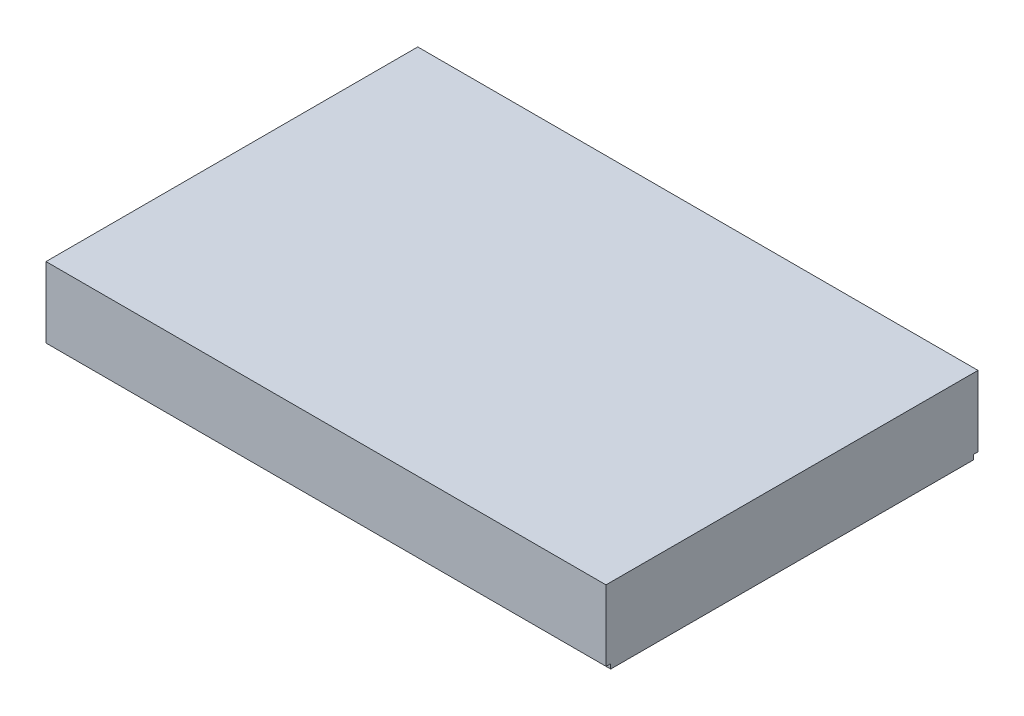
from build123d import *

# Parameters (mm, degrees)
MAINBASESKETCH_W              = 47.8
MAINBASESKETCH_H              = 3.2
MAINBASEEXTRUDE_DEPTH         = 7.9
MAINBASESHELL_T               = -1.2
UNDERSIDECIRCLEEXT_START      = -0.2
UNDERSIDECIRCLESKETCH_R       = 3.25
UNDERSIDECIRCLESKETCH_R_2     = 2.4
UNDERSIDECIRCLEEXT_DEPTH      = 2.4
UNDERSIDECIRCLEPATTERN_COUNT  = 2
UNDERSIDECIRCLEPATTERN_PITCH  = 8
EXTENDEDBASEEDGECUT_DEPTH     = 0.2
EXTENDEDBASEEDGECUT2_DEPTH    = 0.2
EXTENDEDBASEEDGECUT3_DEPTH    = 0.2
EXTENDEDBASEEDGESKETCH4_W     = 47.4
EXTENDEDBASEEDGESKETCH4_H     = 0.199766916
EXTENDEDBASEEDGECUT4_DEPTH    = 0.2
EXTENDEDNBASEUNDERNOTCH_DEPTH = 0.4
EXTENDEBASENOTCHFILLET_R      = 0.2
CUT_EXTRUDE61_DEPTH           = 50.22551315
CUT_EXTRUDE61_DEPTH_BACK      = 50.22551315


with BuildPart() as part:
    # MainBaseSketch → MainBaseExtrude (new, symmetric)
    with BuildSketch(Plane.XY):
        with Locations((24.581967213, 1.6)):
            Rectangle(MAINBASESKETCH_W, MAINBASESKETCH_H)
    extrude(amount=MAINBASEEXTRUDE_DEPTH, both=True)

    # MainBaseShell
    mainbaseshell_openings = [part.faces().sort_by_distance(p)[0] for p in [
        (24.581967213, 0, 0),
    ]]
    offset(amount=MAINBASESHELL_T, openings=mainbaseshell_openings, kind=Kind.INTERSECTION)

    # UnderSideCircleSketch → UnderSideCircleExt (add)
    with BuildSketch(Plane.XZ.offset(-2).offset(UNDERSIDECIRCLEEXT_START)):
        with Locations((8.581967213, 0)):
            Circle(UNDERSIDECIRCLESKETCH_R)
        with Locations((8.581967213, 0)):
            Circle(UNDERSIDECIRCLESKETCH_R_2, mode=Mode.SUBTRACT)
    undersidecircleext = extrude(amount=UNDERSIDECIRCLEEXT_DEPTH)

    # UnderSideCirclePattern: UnderSideCircleExt ×2
    with Locations(*[(i * UNDERSIDECIRCLEPATTERN_PITCH, 0, 0) for i in range(1, UNDERSIDECIRCLEPATTERN_COUNT)]):
        add(undersidecircleext)

    # ExtendedBaseEdgeSketch → ExtendedBaseEdgeCut (cut)
    with BuildSketch(Plane.ZY.offset(-0.681967213)):
        Polygon((-7.9, 0), (-7.9, 0.199766916), (-7.702184024, 0.199766916), (7.702184024, 0.199766916), (7.9, 0.199766916), (7.9, 0), (7.702184024, 0), (-7.702184024, 0), align=None)
    extrude(amount=-EXTENDEDBASEEDGECUT_DEPTH, mode=Mode.SUBTRACT)

    # ExtendedBaseEdgeSketch2 → ExtendedBaseEdgeCut2 (cut)
    with BuildSketch(Plane(origin=(0, 0, -7.9), x_dir=(-1, 0, 0), z_dir=(0, 0, -1))):
        Polygon((-48.481967213, 0), (-48.481967213, 0.203418418), (-0.881967213, 0.199766916), (-0.881967213, 0), align=None)
    extrude(amount=-EXTENDEDBASEEDGECUT2_DEPTH, mode=Mode.SUBTRACT)

    # ExtendedBaseEdgeSketch3 → ExtendedBaseEdgeCut3 (cut)
    with BuildSketch(Plane(origin=(48.481967213, 0, 0), x_dir=(0, 0, -1), z_dir=(1, 0, 0))):
        Polygon((-7.9, 0), (-7.9, 0.199766916), (7.7, 0.203418418), (7.7, 0), align=None)
    extrude(amount=-EXTENDEDBASEEDGECUT3_DEPTH, mode=Mode.SUBTRACT)

    # ExtendedBaseEdgeSketch4 → ExtendedBaseEdgeCut4 (cut)
    with BuildSketch(Plane.XY.offset(7.9)):
        with Locations((24.581967213, 0.099883458)):
            Rectangle(EXTENDEDBASEEDGESKETCH4_W, EXTENDEDBASEEDGESKETCH4_H)
    extrude(amount=-EXTENDEDBASEEDGECUT4_DEPTH, mode=Mode.SUBTRACT)

    # ExtendedbaseUnderNotchSketch → ExtendednbaseUnderNotch (cut)
    with BuildSketch(Plane.XZ.offset(-2)):
        Polygon((1.881967213, 0), (1.881967213, 2.502100162), (2.381942481, 2.502100162), (2.381942481, -2.499482153), (1.881967213, -2.499482153), align=None)
    extrude(amount=-EXTENDEDNBASEUNDERNOTCH_DEPTH, mode=Mode.SUBTRACT)

    # ExtendebaseNotchFillet
    extendebasenotchfillet_edges = [part.edges().sort_by_distance(p)[0] for p in [
        (1.881967213, 2.4, 0.001309004),
        (2.131954847, 2.4, 2.502100162),
        (2.381942481, 2.4, 0.001309004),
        (2.131954847, 2.4, -2.499482153),
    ]]
    fillet(extendebasenotchfillet_edges, radius=EXTENDEBASENOTCHFILLET_R)

    # Sketch180 → Cut-Extrude61 (cut, two sides: drawn at the far end of the back side and taken through both)
    with BuildSketch(Plane(origin=(0, 0, 0), x_dir=(-1, 0, 0), z_dir=(0, -1, 0)).offset(-CUT_EXTRUDE61_DEPTH_BACK)):
        Polygon((-48.481967213, 7.9), (-24.493136363, 7.9), (-24.481967213, -7.9), (-48.481967213, -7.9), align=None)
    extrude(amount=CUT_EXTRUDE61_DEPTH + CUT_EXTRUDE61_DEPTH_BACK, mode=Mode.SUBTRACT)

    # Sweep30: sweep along a curve in space
    with BuildLine() as sweep30_path:
        Line((24.492288074, 0, -6.7), (24.492288074, 2, -6.7))
    # Sketch181 → Sweep30 (sweep)
    with BuildSketch(Plane(origin=(0, 0, 0), x_dir=(-1, 0, 0), z_dir=(0, -1, 0))):
        Polygon((-24.492288074, 6.7), (-23.292288074, 6.7), (-23.292288074, -6.7), (-24.482815503, -6.7), align=None)
    sweep(path=sweep30_path.line)


solid = part.part
